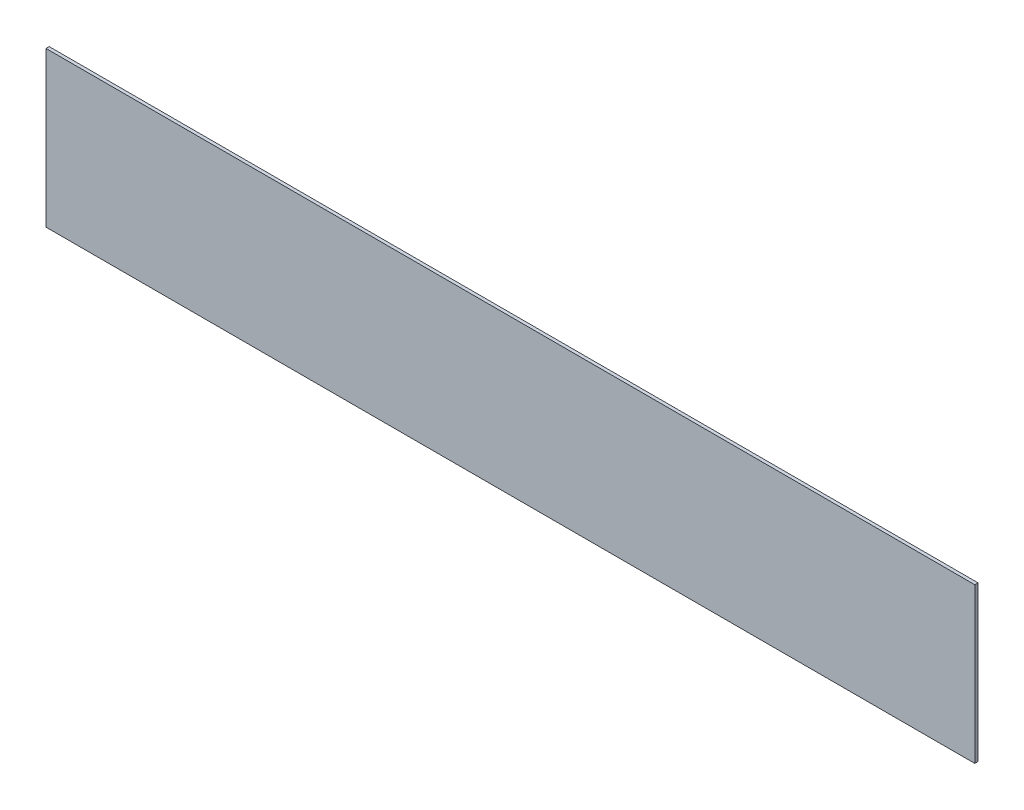
from build123d import *

# Parameters (mm, degrees)
SKETCH1_W           = 914.4
SKETCH1_H           = 152.4
BOSS_EXTRUDE1_DEPTH = 3.175


with BuildPart() as part:
    # Sketch1 → Boss-Extrude1 (new body)
    with BuildSketch(Plane.XY):
        with Locations((457.2, 76.2)):
            Rectangle(SKETCH1_W, SKETCH1_H)
    extrude(amount=BOSS_EXTRUDE1_DEPTH)


solid = part.part
